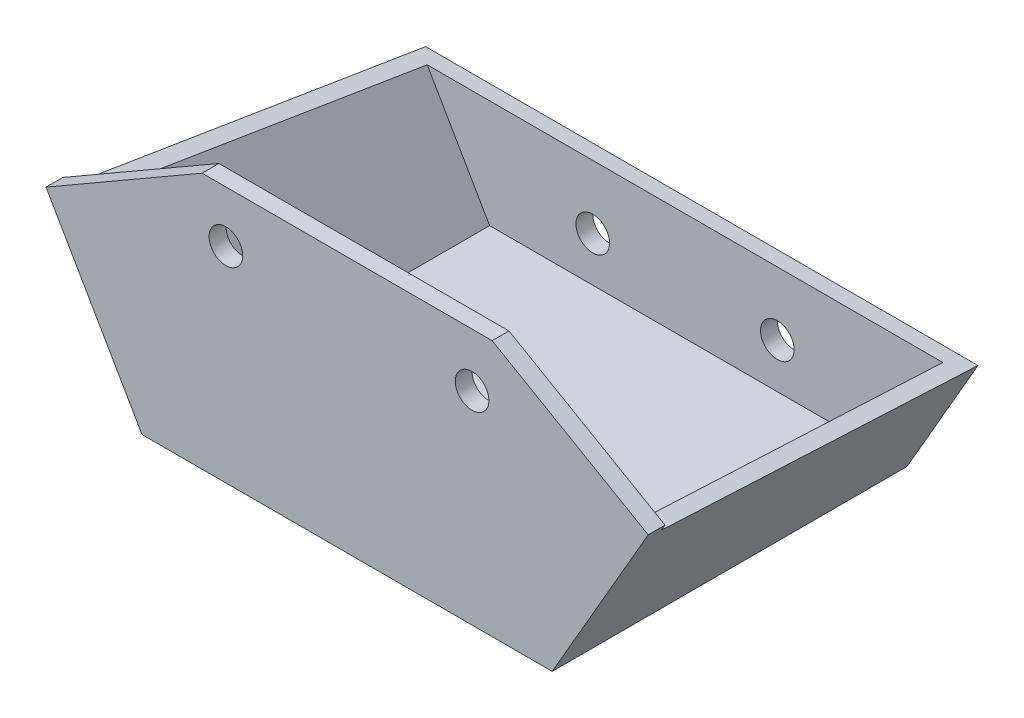
from build123d import *

# Parameters (mm, degrees)
EXTRUDE_1_DEPTH          = 211
SHELL_1_T                = 10
CUT_EXTRUDE_5_REACH      = 317.997
SKETCH_4_R               = 10
CUT_EXTRUDE_6_REACH      = 317.997
SKETCH_5_R               = 10
CUT_EXTRUDE_9_DEPTH      = 316.997319763
CUT_EXTRUDE_9_DEPTH_BACK = 316.997319763


with BuildPart() as part:
    # 草图1 → 凸台-拉伸1 (new body)
    with BuildSketch(Plane.XY):
        Polygon((122, 0), (-122, 0), (-179.100687039, 98.901291098), (-86.265, 152.5), (86.265, 152.5), (179.100687039, 98.901291098), align=None)
    extrude(amount=EXTRUDE_1_DEPTH)

    # 抽壳1 (no face opened: a closed hollow body)
    add(offset(amount=-SHELL_1_T, mode=Mode.PRIVATE), mode=Mode.SUBTRACT)

    # 草图4 → 切除-拉伸5 (cut, up to next)
    with BuildSketch(Plane(origin=(0, 0, 0), x_dir=(-1, 0, 0), z_dir=(0, 0, -1)), mode=Mode.PRIVATE) as cut_extrude_5_sk1:
        with Locations((-54.9, 36.6)):
            Circle(SKETCH_4_R)
    cut_extrude_5_tool1 = extrude(cut_extrude_5_sk1.sketch, amount=-CUT_EXTRUDE_5_REACH, mode=Mode.PRIVATE) & part.part
    # 草图4 → 切除-拉伸5 (cut, up to next)
    with BuildSketch(Plane(origin=(0, 0, 0), x_dir=(-1, 0, 0), z_dir=(0, 0, -1)), mode=Mode.PRIVATE) as cut_extrude_5_sk2:
        with Locations((54.9, 36.6)):
            Circle(SKETCH_4_R)
    cut_extrude_5_tool2 = extrude(cut_extrude_5_sk2.sketch, amount=-CUT_EXTRUDE_5_REACH, mode=Mode.PRIVATE) & part.part
    add(cut_extrude_5_tool1.solids().sort_by_distance((54.9, 36.6, 0))[0], mode=Mode.SUBTRACT)
    add(cut_extrude_5_tool2.solids().sort_by_distance((-54.9, 36.6, 0))[0], mode=Mode.SUBTRACT)

    # 草图5 → 切除-拉伸6 (cut, up to next)
    with BuildSketch(Plane.XY.offset(211), mode=Mode.PRIVATE) as cut_extrude_6_sk1:
        with Locations((-72.089123196, 122)):
            Circle(SKETCH_5_R)
    cut_extrude_6_tool1 = extrude(cut_extrude_6_sk1.sketch, amount=-CUT_EXTRUDE_6_REACH, mode=Mode.PRIVATE) & part.part
    # 草图5 → 切除-拉伸6 (cut, up to next)
    with BuildSketch(Plane.XY.offset(211), mode=Mode.PRIVATE) as cut_extrude_6_sk2:
        with Locations((74.310876804, 120.659584251)):
            Circle(SKETCH_5_R)
    cut_extrude_6_tool2 = extrude(cut_extrude_6_sk2.sketch, amount=-CUT_EXTRUDE_6_REACH, mode=Mode.PRIVATE) & part.part
    add(cut_extrude_6_tool1.solids().sort_by_distance((-72.089123, 122, 211))[0], mode=Mode.SUBTRACT)
    add(cut_extrude_6_tool2.solids().sort_by_distance((74.310877, 120.659584, 211))[0], mode=Mode.SUBTRACT)

    # 草图7 → 切除-拉伸9 (cut, two sides: drawn at the far end of the back side and taken through both)
    with BuildSketch(Plane(origin=(0, 0, 0), x_dir=(0, 0, -1), z_dir=(1, 0, 0)).offset(-CUT_EXTRUDE_9_DEPTH_BACK)):
        Polygon((0, 73.2), (-201, 95.24103706), (-201, 152.5), (0, 152.5), align=None)
    extrude(amount=CUT_EXTRUDE_9_DEPTH + CUT_EXTRUDE_9_DEPTH_BACK, mode=Mode.SUBTRACT)


solid = part.part
